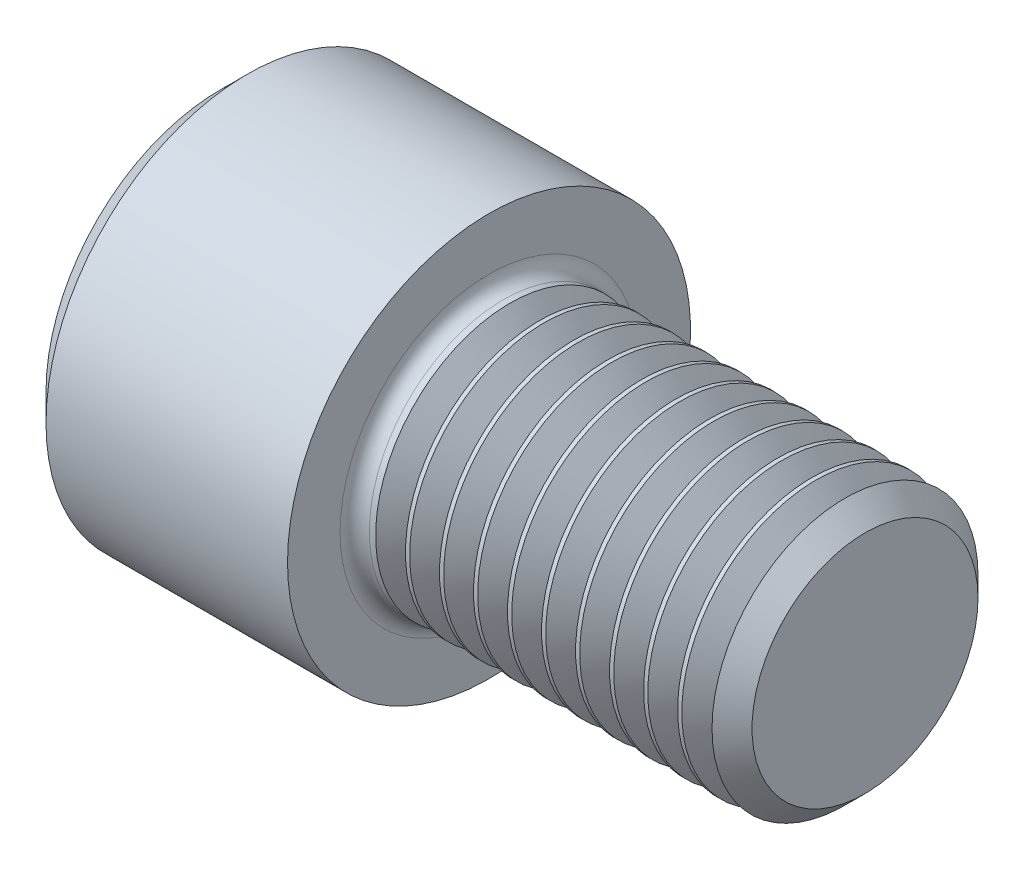
from build123d import *

# Parameters (mm, degrees)
SKETCH1_W            = 7.9375
SKETCH1_H            = 5.95376
SKETCH2_R            = 3.96875
BOSS_EXTRUDE1_DEPTH  = 0.618105268
SKETCH3_R            = 3.96875
BOSS_EXTRUDE2_DEPTH  = 0.441074733
BOSS_EXTRUDE2_TAPER  = 54.999999997
SKETCH4_R            = 3.33883
BOSS_EXTRUDE3_DEPTH  = 0.441074732
BOSS_EXTRUDE3_DRAFT  = -55
SKETCH5_R            = 3.96875
BOSS_EXTRUDE4_DEPTH  = 0.123182535
SKETCH6_R            = 3.96875
BOSS_EXTRUDE5_DEPTH  = 0.441074732
BOSS_EXTRUDE5_TAPER  = 55.000000002
SKETCH7_R            = 3.33883
BOSS_EXTRUDE6_DEPTH  = 0.441074733
BOSS_EXTRUDE6_DRAFT  = -55
SKETCH8_R            = 3.96875
BOSS_EXTRUDE7_DEPTH  = 0.123182535
SKETCH9_R            = 3.96875
BOSS_EXTRUDE8_DEPTH  = 0.441074733
BOSS_EXTRUDE8_TAPER  = 54.999999997
SKETCH10_R           = 3.33883
BOSS_EXTRUDE9_DEPTH  = 0.441074732
BOSS_EXTRUDE9_DRAFT  = -55
SKETCH11_R           = 3.96875
BOSS_EXTRUDE10_DEPTH = 0.123182535
SKETCH12_R           = 3.96875
BOSS_EXTRUDE11_DEPTH = 0.441074733
BOSS_EXTRUDE11_TAPER = 54.999999997
SKETCH13_R           = 3.33883
BOSS_EXTRUDE12_DEPTH = 0.441074732
BOSS_EXTRUDE12_DRAFT = -55
SKETCH14_R           = 3.96875
BOSS_EXTRUDE13_DEPTH = 0.123182535
SKETCH15_R           = 3.96875
BOSS_EXTRUDE14_DEPTH = 0.441074732
BOSS_EXTRUDE14_TAPER = 55.000000002
SKETCH16_R           = 3.33883
BOSS_EXTRUDE15_DEPTH = 0.441074732
BOSS_EXTRUDE15_DRAFT = -55
SKETCH17_R           = 3.96875
BOSS_EXTRUDE16_DEPTH = 0.123182535
SKETCH18_R           = 3.96875
BOSS_EXTRUDE17_DEPTH = 0.441074732
BOSS_EXTRUDE17_TAPER = 55.000000002
SKETCH19_R           = 3.33883
BOSS_EXTRUDE18_DEPTH = 0.441074732
BOSS_EXTRUDE18_DRAFT = -55
SKETCH20_R           = 3.96875
BOSS_EXTRUDE19_DEPTH = 0.123182535
SKETCH21_R           = 3.96875
BOSS_EXTRUDE20_DEPTH = 0.441074732
BOSS_EXTRUDE20_TAPER = 55.000000002
SKETCH22_R           = 3.33883
BOSS_EXTRUDE21_DEPTH = 0.441074733
BOSS_EXTRUDE21_DRAFT = -55
SKETCH23_R           = 3.96875
BOSS_EXTRUDE22_DEPTH = 0.123182535
SKETCH24_R           = 3.96875
BOSS_EXTRUDE23_DEPTH = 0.441074733
BOSS_EXTRUDE23_TAPER = 54.999999997
SKETCH25_R           = 3.33883
BOSS_EXTRUDE24_DEPTH = 0.441074732
BOSS_EXTRUDE24_DRAFT = -55
SKETCH26_R           = 3.96875
BOSS_EXTRUDE25_DEPTH = 0.123182535
SKETCH27_R           = 3.96875
BOSS_EXTRUDE26_DEPTH = 0.441074733
BOSS_EXTRUDE26_TAPER = 54.999999997
SKETCH28_R           = 3.33883
BOSS_EXTRUDE27_DEPTH = 0.441074732
BOSS_EXTRUDE27_DRAFT = -55
SKETCH29_R           = 3.96875
BOSS_EXTRUDE28_DEPTH = 0.123182535
SKETCH30_R           = 3.96875
BOSS_EXTRUDE29_DEPTH = 0.441074733
BOSS_EXTRUDE29_TAPER = 54.999999997
SKETCH31_R           = 3.33883
BOSS_EXTRUDE30_DEPTH = 0.414032422
BOSS_EXTRUDE30_DRAFT = -54.999999999
SKETCH32_R           = 3.930129578
BOSS_EXTRUDE31_DEPTH = 0.591299578
BOSS_EXTRUDE31_TAPER = 45
CUT_EXTRUDE1_DEPTH   = 3.8354
CHAMFER1_SIZE        = 0.8001
FILLET1_R            = 0.4318


with BuildPart() as part:
    # Sketch1 → Revolve1 (revolve)
    with BuildSketch(Plane(origin=(0, 0, 0), x_dir=(-1, 0, 0), z_dir=(0, 0, -1)), mode=Mode.PRIVATE) as revolve1_sk:
        with Locations((-3.96875, 2.97688)):
            Rectangle(SKETCH1_W, SKETCH1_H)
    revolve(revolve1_sk.sketch.rotate(Axis((7.9375, 0, 0), (-1, 0, 0)), 270), axis=Axis((7.9375, 0, 0), (-1, 0, 0)))

    # Sketch2 → Boss-Extrude1 (add)
    with BuildSketch(Plane(origin=(7.9375, 0, 0), x_dir=(0, 0, -1), z_dir=(1, 0, 0))):
        Circle(SKETCH2_R)
    extrude(amount=BOSS_EXTRUDE1_DEPTH)

    # Sketch3 → Boss-Extrude2 (add)
    with BuildSketch(Plane(origin=(8.555605268, 0, 0), x_dir=(0, 0, -1), z_dir=(1, 0, 0))):
        Circle(SKETCH3_R)
    extrude(amount=BOSS_EXTRUDE2_DEPTH, taper=BOSS_EXTRUDE2_TAPER)


with BuildPart() as boss_extrude3_tool:
    # Sketch4 → Boss-Extrude3 (with draft: the straight prism first)
    with BuildSketch(Plane(origin=(8.99668, 0, 0), x_dir=(0, 0, -1), z_dir=(1, 0, 0))):
        Circle(SKETCH4_R)
    extrude(amount=BOSS_EXTRUDE3_DEPTH)
    # Boss-Extrude3: the draft: its side faces are tilted about the plane it starts from
    boss_extrude3_sides = [boss_extrude3_tool.faces().sort_by_distance(p)[0] for p in [
        (9.217217366, 0, 3.33883),
    ]]
    draft(boss_extrude3_sides, Plane(origin=(8.99668, 0, 0), x_dir=(0, 0, -1), z_dir=(1, 0, 0)), BOSS_EXTRUDE3_DRAFT)


with BuildPart() as part_1:
    add(part.part)

    # Boss-Extrude3: add boss_extrude3_tool
    add(boss_extrude3_tool.part)

    # Sketch5 → Boss-Extrude4 (add)
    with BuildSketch(Plane(origin=(9.437754732, 0, 0), x_dir=(0, 0, -1), z_dir=(1, 0, 0))):
        Circle(SKETCH5_R)
    extrude(amount=BOSS_EXTRUDE4_DEPTH)

    # Sketch6 → Boss-Extrude5 (add)
    with BuildSketch(Plane(origin=(9.560937268, 0, 0), x_dir=(0, 0, -1), z_dir=(1, 0, 0))):
        Circle(SKETCH6_R)
    extrude(amount=BOSS_EXTRUDE5_DEPTH, taper=BOSS_EXTRUDE5_TAPER)


with BuildPart() as boss_extrude6_tool:
    # Sketch7 → Boss-Extrude6 (with draft: the straight prism first)
    with BuildSketch(Plane(origin=(10.002012, 0, 0), x_dir=(0, 0, -1), z_dir=(1, 0, 0))):
        Circle(SKETCH7_R)
    extrude(amount=BOSS_EXTRUDE6_DEPTH)
    # Boss-Extrude6: the draft: its side faces are tilted about the plane it starts from
    boss_extrude6_sides = [boss_extrude6_tool.faces().sort_by_distance(p)[0] for p in [
        (10.222549366, 0, 3.33883),
    ]]
    draft(boss_extrude6_sides, Plane(origin=(10.002012, 0, 0), x_dir=(0, 0, -1), z_dir=(1, 0, 0)), BOSS_EXTRUDE6_DRAFT)


with BuildPart() as part_2:
    add(part_1.part)

    # Boss-Extrude6: add boss_extrude6_tool
    add(boss_extrude6_tool.part)

    # Sketch8 → Boss-Extrude7 (add)
    with BuildSketch(Plane(origin=(10.443086732, 0, 0), x_dir=(0, 0, -1), z_dir=(1, 0, 0))):
        Circle(SKETCH8_R)
    extrude(amount=BOSS_EXTRUDE7_DEPTH)

    # Sketch9 → Boss-Extrude8 (add)
    with BuildSketch(Plane(origin=(10.566269268, 0, 0), x_dir=(0, 0, -1), z_dir=(1, 0, 0))):
        Circle(SKETCH9_R)
    extrude(amount=BOSS_EXTRUDE8_DEPTH, taper=BOSS_EXTRUDE8_TAPER)


with BuildPart() as boss_extrude9_tool:
    # Sketch10 → Boss-Extrude9 (with draft: the straight prism first)
    with BuildSketch(Plane(origin=(11.007344, 0, 0), x_dir=(0, 0, -1), z_dir=(1, 0, 0))):
        Circle(SKETCH10_R)
    extrude(amount=BOSS_EXTRUDE9_DEPTH)
    # Boss-Extrude9: the draft: its side faces are tilted about the plane it starts from
    boss_extrude9_sides = [boss_extrude9_tool.faces().sort_by_distance(p)[0] for p in [
        (11.227881366, 0, 3.33883),
    ]]
    draft(boss_extrude9_sides, Plane(origin=(11.007344, 0, 0), x_dir=(0, 0, -1), z_dir=(1, 0, 0)), BOSS_EXTRUDE9_DRAFT)


with BuildPart() as part_3:
    add(part_2.part)

    # Boss-Extrude9: add boss_extrude9_tool
    add(boss_extrude9_tool.part)

    # Sketch11 → Boss-Extrude10 (add)
    with BuildSketch(Plane(origin=(11.448418732, 0, 0), x_dir=(0, 0, -1), z_dir=(1, 0, 0))):
        Circle(SKETCH11_R)
    extrude(amount=BOSS_EXTRUDE10_DEPTH)

    # Sketch12 → Boss-Extrude11 (add)
    with BuildSketch(Plane(origin=(11.571601268, 0, 0), x_dir=(0, 0, -1), z_dir=(1, 0, 0))):
        Circle(SKETCH12_R)
    extrude(amount=BOSS_EXTRUDE11_DEPTH, taper=BOSS_EXTRUDE11_TAPER)


with BuildPart() as boss_extrude12_tool:
    # Sketch13 → Boss-Extrude12 (with draft: the straight prism first)
    with BuildSketch(Plane(origin=(12.012676, 0, 0), x_dir=(0, 0, -1), z_dir=(1, 0, 0))):
        Circle(SKETCH13_R)
    extrude(amount=BOSS_EXTRUDE12_DEPTH)
    # Boss-Extrude12: the draft: its side faces are tilted about the plane it starts from
    boss_extrude12_sides = [boss_extrude12_tool.faces().sort_by_distance(p)[0] for p in [
        (12.233213366, 0, 3.33883),
    ]]
    draft(boss_extrude12_sides, Plane(origin=(12.012676, 0, 0), x_dir=(0, 0, -1), z_dir=(1, 0, 0)), BOSS_EXTRUDE12_DRAFT)


with BuildPart() as part_4:
    add(part_3.part)

    # Boss-Extrude12: add boss_extrude12_tool
    add(boss_extrude12_tool.part)

    # Sketch14 → Boss-Extrude13 (add)
    with BuildSketch(Plane(origin=(12.453750732, 0, 0), x_dir=(0, 0, -1), z_dir=(1, 0, 0))):
        Circle(SKETCH14_R)
    extrude(amount=BOSS_EXTRUDE13_DEPTH)

    # Sketch15 → Boss-Extrude14 (add)
    with BuildSketch(Plane(origin=(12.576933268, 0, 0), x_dir=(0, 0, -1), z_dir=(1, 0, 0))):
        Circle(SKETCH15_R)
    extrude(amount=BOSS_EXTRUDE14_DEPTH, taper=BOSS_EXTRUDE14_TAPER)


with BuildPart() as boss_extrude15_tool:
    # Sketch16 → Boss-Extrude15 (with draft: the straight prism first)
    with BuildSketch(Plane(origin=(13.018008, 0, 0), x_dir=(0, 0, -1), z_dir=(1, 0, 0))):
        Circle(SKETCH16_R)
    extrude(amount=BOSS_EXTRUDE15_DEPTH)
    # Boss-Extrude15: the draft: its side faces are tilted about the plane it starts from
    boss_extrude15_sides = [boss_extrude15_tool.faces().sort_by_distance(p)[0] for p in [
        (13.238545366, 0, 3.33883),
    ]]
    draft(boss_extrude15_sides, Plane(origin=(13.018008, 0, 0), x_dir=(0, 0, -1), z_dir=(1, 0, 0)), BOSS_EXTRUDE15_DRAFT)


with BuildPart() as part_5:
    add(part_4.part)

    # Boss-Extrude15: add boss_extrude15_tool
    add(boss_extrude15_tool.part)

    # Sketch17 → Boss-Extrude16 (add)
    with BuildSketch(Plane(origin=(13.459082732, 0, 0), x_dir=(0, 0, -1), z_dir=(1, 0, 0))):
        Circle(SKETCH17_R)
    extrude(amount=BOSS_EXTRUDE16_DEPTH)

    # Sketch18 → Boss-Extrude17 (add)
    with BuildSketch(Plane(origin=(13.582265268, 0, 0), x_dir=(0, 0, -1), z_dir=(1, 0, 0))):
        Circle(SKETCH18_R)
    extrude(amount=BOSS_EXTRUDE17_DEPTH, taper=BOSS_EXTRUDE17_TAPER)


with BuildPart() as boss_extrude18_tool:
    # Sketch19 → Boss-Extrude18 (with draft: the straight prism first)
    with BuildSketch(Plane(origin=(14.02334, 0, 0), x_dir=(0, 0, -1), z_dir=(1, 0, 0))):
        Circle(SKETCH19_R)
    extrude(amount=BOSS_EXTRUDE18_DEPTH)
    # Boss-Extrude18: the draft: its side faces are tilted about the plane it starts from
    boss_extrude18_sides = [boss_extrude18_tool.faces().sort_by_distance(p)[0] for p in [
        (14.243877366, 0, 3.33883),
    ]]
    draft(boss_extrude18_sides, Plane(origin=(14.02334, 0, 0), x_dir=(0, 0, -1), z_dir=(1, 0, 0)), BOSS_EXTRUDE18_DRAFT)


with BuildPart() as part_6:
    add(part_5.part)

    # Boss-Extrude18: add boss_extrude18_tool
    add(boss_extrude18_tool.part)

    # Sketch20 → Boss-Extrude19 (add)
    with BuildSketch(Plane(origin=(14.464414732, 0, 0), x_dir=(0, 0, -1), z_dir=(1, 0, 0))):
        Circle(SKETCH20_R)
    extrude(amount=BOSS_EXTRUDE19_DEPTH)

    # Sketch21 → Boss-Extrude20 (add)
    with BuildSketch(Plane(origin=(14.587597268, 0, 0), x_dir=(0, 0, -1), z_dir=(1, 0, 0))):
        Circle(SKETCH21_R)
    extrude(amount=BOSS_EXTRUDE20_DEPTH, taper=BOSS_EXTRUDE20_TAPER)


with BuildPart() as boss_extrude21_tool:
    # Sketch22 → Boss-Extrude21 (with draft: the straight prism first)
    with BuildSketch(Plane(origin=(15.028672, 0, 0), x_dir=(0, 0, -1), z_dir=(1, 0, 0))):
        Circle(SKETCH22_R)
    extrude(amount=BOSS_EXTRUDE21_DEPTH)
    # Boss-Extrude21: the draft: its side faces are tilted about the plane it starts from
    boss_extrude21_sides = [boss_extrude21_tool.faces().sort_by_distance(p)[0] for p in [
        (15.249209366, 0, 3.33883),
    ]]
    draft(boss_extrude21_sides, Plane(origin=(15.028672, 0, 0), x_dir=(0, 0, -1), z_dir=(1, 0, 0)), BOSS_EXTRUDE21_DRAFT)


with BuildPart() as part_7:
    add(part_6.part)

    # Boss-Extrude21: add boss_extrude21_tool
    add(boss_extrude21_tool.part)

    # Sketch23 → Boss-Extrude22 (add)
    with BuildSketch(Plane(origin=(15.469746732, 0, 0), x_dir=(0, 0, -1), z_dir=(1, 0, 0))):
        Circle(SKETCH23_R)
    extrude(amount=BOSS_EXTRUDE22_DEPTH)

    # Sketch24 → Boss-Extrude23 (add)
    with BuildSketch(Plane(origin=(15.592929268, 0, 0), x_dir=(0, 0, -1), z_dir=(1, 0, 0))):
        Circle(SKETCH24_R)
    extrude(amount=BOSS_EXTRUDE23_DEPTH, taper=BOSS_EXTRUDE23_TAPER)


with BuildPart() as boss_extrude24_tool:
    # Sketch25 → Boss-Extrude24 (with draft: the straight prism first)
    with BuildSketch(Plane(origin=(16.034004, 0, 0), x_dir=(0, 0, -1), z_dir=(1, 0, 0))):
        Circle(SKETCH25_R)
    extrude(amount=BOSS_EXTRUDE24_DEPTH)
    # Boss-Extrude24: the draft: its side faces are tilted about the plane it starts from
    boss_extrude24_sides = [boss_extrude24_tool.faces().sort_by_distance(p)[0] for p in [
        (16.254541366, 0, 3.33883),
    ]]
    draft(boss_extrude24_sides, Plane(origin=(16.034004, 0, 0), x_dir=(0, 0, -1), z_dir=(1, 0, 0)), BOSS_EXTRUDE24_DRAFT)


with BuildPart() as part_8:
    add(part_7.part)

    # Boss-Extrude24: add boss_extrude24_tool
    add(boss_extrude24_tool.part)

    # Sketch26 → Boss-Extrude25 (add)
    with BuildSketch(Plane(origin=(16.475078732, 0, 0), x_dir=(0, 0, -1), z_dir=(1, 0, 0))):
        Circle(SKETCH26_R)
    extrude(amount=BOSS_EXTRUDE25_DEPTH)

    # Sketch27 → Boss-Extrude26 (add)
    with BuildSketch(Plane(origin=(16.598261268, 0, 0), x_dir=(0, 0, -1), z_dir=(1, 0, 0))):
        Circle(SKETCH27_R)
    extrude(amount=BOSS_EXTRUDE26_DEPTH, taper=BOSS_EXTRUDE26_TAPER)


with BuildPart() as boss_extrude27_tool:
    # Sketch28 → Boss-Extrude27 (with draft: the straight prism first)
    with BuildSketch(Plane(origin=(17.039336, 0, 0), x_dir=(0, 0, -1), z_dir=(1, 0, 0))):
        Circle(SKETCH28_R)
    extrude(amount=BOSS_EXTRUDE27_DEPTH)
    # Boss-Extrude27: the draft: its side faces are tilted about the plane it starts from
    boss_extrude27_sides = [boss_extrude27_tool.faces().sort_by_distance(p)[0] for p in [
        (17.259873366, 0, 3.33883),
    ]]
    draft(boss_extrude27_sides, Plane(origin=(17.039336, 0, 0), x_dir=(0, 0, -1), z_dir=(1, 0, 0)), BOSS_EXTRUDE27_DRAFT)


with BuildPart() as part_9:
    add(part_8.part)

    # Boss-Extrude27: add boss_extrude27_tool
    add(boss_extrude27_tool.part)

    # Sketch29 → Boss-Extrude28 (add)
    with BuildSketch(Plane(origin=(17.480410732, 0, 0), x_dir=(0, 0, -1), z_dir=(1, 0, 0))):
        Circle(SKETCH29_R)
    extrude(amount=BOSS_EXTRUDE28_DEPTH)

    # Sketch30 → Boss-Extrude29 (add)
    with BuildSketch(Plane(origin=(17.603593268, 0, 0), x_dir=(0, 0, -1), z_dir=(1, 0, 0))):
        Circle(SKETCH30_R)
    extrude(amount=BOSS_EXTRUDE29_DEPTH, taper=BOSS_EXTRUDE29_TAPER)


with BuildPart() as boss_extrude30_tool:
    # Sketch31 → Boss-Extrude30 (with draft: the straight prism first)
    with BuildSketch(Plane(origin=(18.044668, 0, 0), x_dir=(0, 0, -1), z_dir=(1, 0, 0))):
        Circle(SKETCH31_R)
    extrude(amount=BOSS_EXTRUDE30_DEPTH)
    # Boss-Extrude30: the draft: its side faces are tilted about the plane it starts from
    boss_extrude30_sides = [boss_extrude30_tool.faces().sort_by_distance(p)[0] for p in [
        (18.251684211, 0, 3.33883),
    ]]
    draft(boss_extrude30_sides, Plane(origin=(18.044668, 0, 0), x_dir=(0, 0, -1), z_dir=(1, 0, 0)), BOSS_EXTRUDE30_DRAFT)


with BuildPart() as part_10:
    add(part_9.part)

    # Boss-Extrude30: add boss_extrude30_tool
    add(boss_extrude30_tool.part)

    # Sketch32 → Boss-Extrude31 (add)
    with BuildSketch(Plane(origin=(18.458700422, 0, 0), x_dir=(0, 0, -1), z_dir=(1, 0, 0))):
        Circle(SKETCH32_R)
    extrude(amount=BOSS_EXTRUDE31_DEPTH, taper=BOSS_EXTRUDE31_TAPER)

    # Sketch33 → Cut-Extrude1 (cut)
    with BuildSketch(Plane.ZY):
        Polygon((-3.175, -1.833087105), (0, -3.666174209), (3.175, -1.833087105), (3.175, 1.833087105), (0, 3.666174209), (-3.175, 1.833087105), align=None)
    extrude(amount=-CUT_EXTRUDE1_DEPTH, mode=Mode.SUBTRACT)

    # Sketch34 → Cut-Revolve1 (revolve, cut)
    with BuildSketch(Plane.XY, mode=Mode.PRIVATE) as cut_revolve1_sk:
        Polygon((3.8354, 3.175), (3.8354, 0), (5.668487105, 0), align=None)
    revolve(cut_revolve1_sk.sketch.rotate(Axis((3.835375, 0, 0), (1, 0, 0)), 180), axis=Axis((3.835375, 0, 0), (1, 0, 0)), mode=Mode.SUBTRACT)

    # Chamfer1
    chamfer1_edges = [part_10.edges().sort_by_distance(p)[0] for p in [
        (0, 0, -5.95376),
    ]]
    chamfer(chamfer1_edges, length=CHAMFER1_SIZE)

    # Fillet1
    fillet1_edges = [part_10.edges().sort_by_distance(p)[0] for p in [
        (7.9375, 0, 3.96875),
    ]]
    fillet(fillet1_edges, radius=FILLET1_R)


solid = part_10.part
